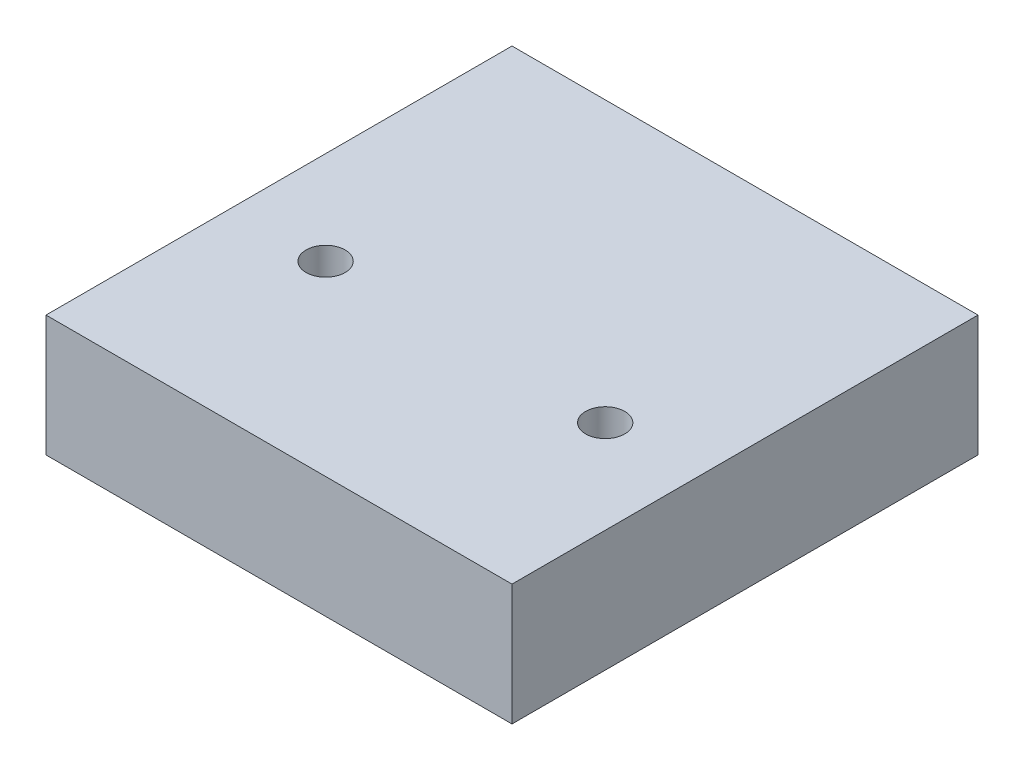
from build123d import *

# Parameters (mm, degrees)
SKETCH_1_W          = 50
SKETCH_1_H          = 50
EXTRUDE_1_DEPTH     = 13
CUT_EXTRUDE_1_REACH = 39.67
SKETCH_3_R          = 2.1


with BuildPart() as part:
    # 草图1 → 凸台-拉伸1 (new body)
    with BuildSketch(Plane(origin=(0, 0, 0), x_dir=(1, 0, 0), z_dir=(0, 1, 0))):
        Rectangle(SKETCH_1_W, SKETCH_1_H)
    extrude(amount=EXTRUDE_1_DEPTH)

    # 草图3 → 切除-拉伸1 (cut, up to next)
    with BuildSketch(Plane(origin=(0, 13, 0), x_dir=(1, 0, 0), z_dir=(0, 1, 0)), mode=Mode.PRIVATE) as cut_extrude_1_sk1:
        with Locations(Location((-15, -5, 0), (0, 0, 270))):
            Circle(SKETCH_3_R)
    cut_extrude_1_tool1 = extrude(cut_extrude_1_sk1.sketch, amount=-CUT_EXTRUDE_1_REACH, mode=Mode.PRIVATE) & part.part
    # 草图3 → 切除-拉伸1 (cut, up to next)
    with BuildSketch(Plane(origin=(0, 13, 0), x_dir=(1, 0, 0), z_dir=(0, 1, 0)), mode=Mode.PRIVATE) as cut_extrude_1_sk2:
        with Locations(Location((15, -5, 0), (0, 0, 270))):
            Circle(SKETCH_3_R)
    cut_extrude_1_tool2 = extrude(cut_extrude_1_sk2.sketch, amount=-CUT_EXTRUDE_1_REACH, mode=Mode.PRIVATE) & part.part
    add(cut_extrude_1_tool1.solids().sort_by_distance((-15, 13, 5))[0], mode=Mode.SUBTRACT)
    add(cut_extrude_1_tool2.solids().sort_by_distance((15, 13, 5))[0], mode=Mode.SUBTRACT)


solid = part.part
